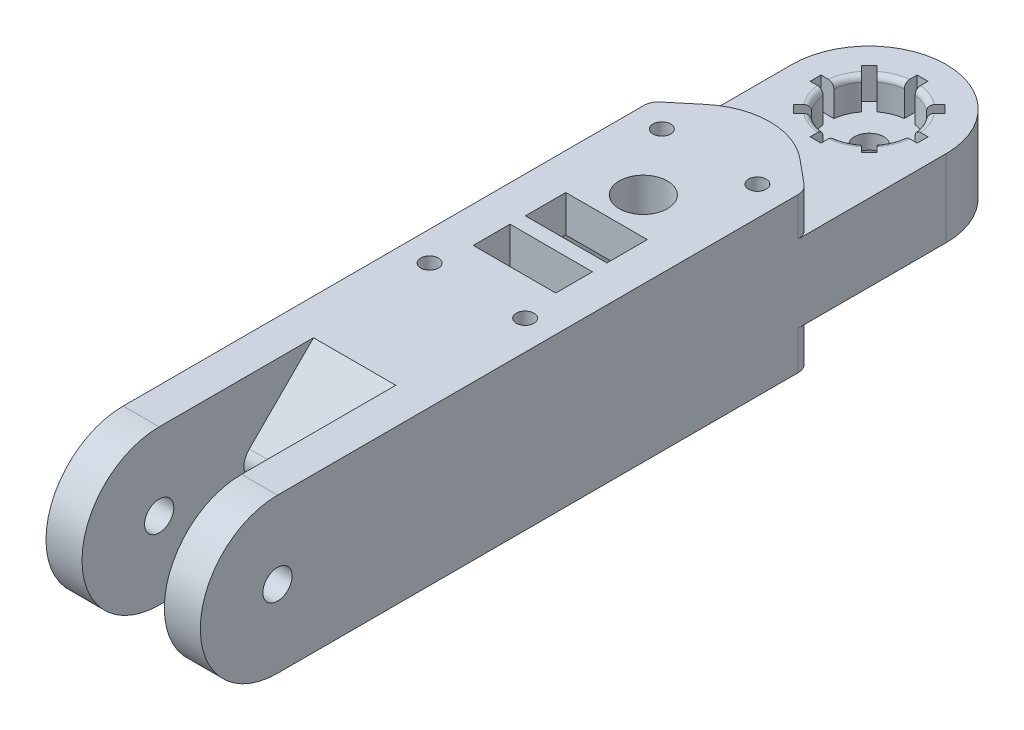
from build123d import *

# Parameters (mm, degrees)
SKETCH1_W                = 42
SKETCH1_H                = 42
BOSS_EXTRUDE1_DEPTH      = 140
SKETCH2_W                = 9.8
SKETCH2_H                = 42
BOSS_EXTRUDE2_DEPTH      = 21
BOSS_EXTRUDE4_DEPTH      = 9.8
BOSS_EXTRUDE5_START      = -9.8
BOSS_EXTRUDE5_DEPTH      = 9.8
SKETCH6_R                = 3.975
CUT_EXTRUDE1_DEPTH       = 187.015698262
SKETCH8_R                = 3.975
CUT_EXTRUDE2_DEPTH       = 187.015698262
SKETCH9_W                = 42
SKETCH9_H                = 21
BOSS_EXTRUDE6_DEPTH      = 21
BOSS_EXTRUDE7_DEPTH      = 21
SKETCH11_R               = 11.35
CUT_EXTRUDE3_DEPTH       = 8.5
CUT_EXTRUDE4_DEPTH       = 22.4
FILLET1_R                = 5
SKETCH18_R               = 11.1605
CUT_EXTRUDE5_DEPTH       = 8.5
SKETCH19_R               = 3.975
CUT_EXTRUDE6_DEPTH       = 8.5
FILLET4_R                = 1.5
FILLET5_R                = 1.5
SKETCH20_W               = 2.96
SKETCH20_H               = 3.81
CUT_EXTRUDE7_DEPTH       = 8.5
CIRPATTERN1_COUNT        = 8
MIRROR1_COPY_1_SKETCH_W  = 2.96
MIRROR1_COPY_1_SKETCH_H  = 3.81
MIRROR1_COPY_1_DEPTH     = 8.5
MIRROR1_COPY_2_SKETCH_W  = 2.96
MIRROR1_COPY_2_SKETCH_H  = 3.81
MIRROR1_COPY_2_DEPTH     = 8.5
MIRROR1_COPY_3_SKETCH_W  = 2.96
MIRROR1_COPY_3_SKETCH_H  = 3.81
MIRROR1_COPY_3_DEPTH     = 8.5
MIRROR1_COPY_4_SKETCH_W  = 2.96
MIRROR1_COPY_4_SKETCH_H  = 3.81
MIRROR1_COPY_4_DEPTH     = 8.5
MIRROR1_COPY_5_SKETCH_W  = 2.96
MIRROR1_COPY_5_SKETCH_H  = 3.81
MIRROR1_COPY_5_DEPTH     = 8.5
MIRROR1_COPY_6_SKETCH_W  = 2.96
MIRROR1_COPY_6_SKETCH_H  = 3.81
MIRROR1_COPY_6_DEPTH     = 8.5
MIRROR1_COPY_7_SKETCH_W  = 2.96
MIRROR1_COPY_7_SKETCH_H  = 3.81
MIRROR1_COPY_7_DEPTH     = 8.5
SKETCH25_W               = 34
SKETCH25_H               = 49
CUT_EXTRUDE11_DEPTH      = 32
SKETCH26_W               = 17
SKETCH26_H               = 3
SKETCH26_H_2             = 8.1
CUT_EXTRUDE12_DEPTH      = 27
SKETCH30_R               = 2.4
CUT_EXTRUDE13_DEPTH      = 186.186392589
FILLET10_R               = 3
MIRROR12_COPY_1_SKETCH_R = 2.4
MIRROR12_COPY_1_DEPTH    = 186.186392589
FILLET10_OF_MIRROR12_R   = 3
CUT_EXTRUDE16_DEPTH      = 10.5
FILLET12_R               = 20
FILLET12_OF_MIRROR13_R   = 20
FILLET13_R               = 4
SKETCH33_R               = 6.56
SKETCH33_W               = 22.45
SKETCH33_H               = 10
SKETCH33_W_2             = 22.2
SKETCH33_H_2             = 11
CUT_EXTRUDE17_DEPTH      = 186.981181844


with BuildPart() as part:
    # Sketch1 → Boss-Extrude1 (new body)
    with BuildSketch(Plane.XY):
        Rectangle(SKETCH1_W, SKETCH1_H)
    extrude(amount=BOSS_EXTRUDE1_DEPTH)

    # Sketch2 → Boss-Extrude2 (add)
    with BuildSketch(Plane.XY.offset(140)):
        with Locations((-16.1, 0)):
            Rectangle(SKETCH2_W, SKETCH2_H)
        with Locations((16.1, 0)):
            Rectangle(SKETCH2_W, SKETCH2_H)
    extrude(amount=BOSS_EXTRUDE2_DEPTH)

    # Sketch5 → Boss-Extrude4 (add)
    with BuildSketch(Plane.ZY.offset(-11.2)):
        with BuildLine():
            ThreePointArc((161, 21), (182, 0), (161, -21))
            Line((161, -21), (161, 21))
        make_face()
    extrude(amount=-BOSS_EXTRUDE4_DEPTH)

    # Sketch3 → Boss-Extrude5 (add)
    with BuildSketch(Plane(origin=(-11.2, 0, 0), x_dir=(0, 0, -1), z_dir=(1, 0, 0)).offset(BOSS_EXTRUDE5_START)):
        with BuildLine():
            Line((-161, -21), (-161, 21))
            ThreePointArc((-161, 21), (-182, 0), (-161, -21))
        make_face()
    extrude(amount=BOSS_EXTRUDE5_DEPTH)

    # Sketch6 → Cut-Extrude1 (cut, through all)
    with BuildSketch(Plane.ZY.offset(-11.2)):
        with Locations(Location((161, 0, 0), (0, 0, 270))):
            Circle(SKETCH6_R)
    extrude(amount=-CUT_EXTRUDE1_DEPTH, mode=Mode.SUBTRACT)

    # Sketch8 → Cut-Extrude2 (cut, through all)
    with BuildSketch(Plane(origin=(-11.2, 0, 0), x_dir=(0, 0, -1), z_dir=(1, 0, 0))):
        with Locations(Location((-161, 0, 0), (0, 0, 270))):
            Circle(SKETCH8_R)
    extrude(amount=-CUT_EXTRUDE2_DEPTH, mode=Mode.SUBTRACT)

    # Sketch9 → Boss-Extrude6 (add)
    with BuildSketch(Plane(origin=(0, 0, 0), x_dir=(-1, 0, 0), z_dir=(0, 0, -1))):
        Rectangle(SKETCH9_W, SKETCH9_H)
    extrude(amount=BOSS_EXTRUDE6_DEPTH)

    # Sketch10 → Boss-Extrude7 (add)
    with BuildSketch(Plane(origin=(0, -10.5, 0), x_dir=(-1, 0, 0), z_dir=(0, -1, 0))):
        with BuildLine():
            Line((-21, 21), (21, 21))
            ThreePointArc((21, 21), (0, 42), (-21, 21))
        make_face()
    extrude(amount=-BOSS_EXTRUDE7_DEPTH)

    # Sketch11 → Cut-Extrude3 (cut)
    with BuildSketch(Plane(origin=(0, -10.5, 0), x_dir=(-1, 0, 0), z_dir=(0, -1, 0))):
        with Locations(Location((0, 21, 0), (0, 0, 180))):
            Circle(SKETCH11_R)
    extrude(amount=-CUT_EXTRUDE3_DEPTH, mode=Mode.SUBTRACT)

    # Sketch16 → Cut-Extrude4 (cut)
    with BuildSketch(Plane.ZY.offset(-11.2)):
        Polygon((140, -21), (140, 0), (119, -21), align=None)
        Polygon((140, 0), (140, 21), (119, 21), align=None)
    extrude(amount=CUT_EXTRUDE4_DEPTH, mode=Mode.SUBTRACT)

    # Fillet1
    fillet1_edges = [part.edges().sort_by_distance(p)[0] for p in [
        (0, 0, 140),
    ]]
    fillet(fillet1_edges, radius=FILLET1_R)

    # Sketch18 → Cut-Extrude5 (cut)
    with BuildSketch(Plane(origin=(0, 10.5, 0), x_dir=(1, 0, 0), z_dir=(0, 1, 0))):
        with Locations(Location((0, 21, 0), (0, 0, 180))):
            Circle(SKETCH18_R)
    extrude(amount=-CUT_EXTRUDE5_DEPTH, mode=Mode.SUBTRACT)

    # Sketch19 → Cut-Extrude6 (cut)
    with BuildSketch(Plane.XZ.offset(2)):
        with Locations((0, -21)):
            Circle(SKETCH19_R)
    extrude(amount=-CUT_EXTRUDE6_DEPTH, mode=Mode.SUBTRACT)

    # Fillet4
    fillet4_edges = [part.edges().sort_by_distance(p)[0] for p in [
        (-11.35, -10.5, -21),
    ]]
    fillet(fillet4_edges, radius=FILLET4_R)

    # Fillet5
    fillet5_edges = [part.edges().sort_by_distance(p)[0] for p in [
        (11.1605, 10.5, -21),
    ]]
    fillet(fillet5_edges, radius=FILLET5_R)

    # Sketch20 → Cut-Extrude7 (cut)
    with BuildSketch(Plane(origin=(0, 10.5, 0), x_dir=(1, 0, 0), z_dir=(0, 1, 0))):
        with Locations((0, 33.6605)):
            Rectangle(SKETCH20_W, SKETCH20_H)
    cut_extrude7 = extrude(amount=-CUT_EXTRUDE7_DEPTH, mode=Mode.SUBTRACT)

    # CirPattern1: Cut-Extrude7 ×8 about axis
    cirpattern1_axis = Axis((0, 0, -21), (0, 1, 0))
    for i in range(1, CIRPATTERN1_COUNT):
        add(cut_extrude7.rotate(cirpattern1_axis, i * 360 / CIRPATTERN1_COUNT), mode=Mode.SUBTRACT)

    # Mirror1: Cut-Extrude7 across plane
    add(cut_extrude7.mirror(Plane.ZX), mode=Mode.SUBTRACT)

    # Mirror1 copy 1 sketch → Mirror1 copy 1 (cut)
    with BuildSketch(Plane(origin=(14.849242405, -10.5, -6.150757595), x_dir=(0.7071067811865476, 0, -0.7071067811865475), z_dir=(0, -1, 0))):
        with Locations((0, -33.6605)):
            Rectangle(MIRROR1_COPY_1_SKETCH_W, MIRROR1_COPY_1_SKETCH_H)
    extrude(amount=-MIRROR1_COPY_1_DEPTH, mode=Mode.SUBTRACT)

    # Mirror1 copy 2 sketch → Mirror1 copy 2 (cut)
    with BuildSketch(Plane(origin=(21, -10.5, -21), x_dir=(0, 0, -1), z_dir=(0, -1, 0))):
        with Locations((0, -33.6605)):
            Rectangle(MIRROR1_COPY_2_SKETCH_W, MIRROR1_COPY_2_SKETCH_H)
    extrude(amount=-MIRROR1_COPY_2_DEPTH, mode=Mode.SUBTRACT)

    # Mirror1 copy 3 sketch → Mirror1 copy 3 (cut)
    with BuildSketch(Plane(origin=(14.849242405, -10.5, -35.849242405), x_dir=(-0.7071067811865475, 0, -0.7071067811865476), z_dir=(0, -1, 0))):
        with Locations((0, -33.6605)):
            Rectangle(MIRROR1_COPY_3_SKETCH_W, MIRROR1_COPY_3_SKETCH_H)
    extrude(amount=-MIRROR1_COPY_3_DEPTH, mode=Mode.SUBTRACT)

    # Mirror1 copy 4 sketch → Mirror1 copy 4 (cut)
    with BuildSketch(Plane(origin=(0, -10.5, -42), x_dir=(-1, 0, 0), z_dir=(0, -1, 0))):
        with Locations((0, -33.6605)):
            Rectangle(MIRROR1_COPY_4_SKETCH_W, MIRROR1_COPY_4_SKETCH_H)
    extrude(amount=-MIRROR1_COPY_4_DEPTH, mode=Mode.SUBTRACT)

    # Mirror1 copy 5 sketch → Mirror1 copy 5 (cut)
    with BuildSketch(Plane(origin=(-14.849242405, -10.5, -35.849242405), x_dir=(-0.7071067811865477, 0, 0.7071067811865475), z_dir=(0, -1, 0))):
        with Locations((0, -33.6605)):
            Rectangle(MIRROR1_COPY_5_SKETCH_W, MIRROR1_COPY_5_SKETCH_H)
    extrude(amount=-MIRROR1_COPY_5_DEPTH, mode=Mode.SUBTRACT)

    # Mirror1 copy 6 sketch → Mirror1 copy 6 (cut)
    with BuildSketch(Plane(origin=(-21, -10.5, -21), x_dir=(0, 0, 1), z_dir=(0, -1, 0))):
        with Locations((0, -33.6605)):
            Rectangle(MIRROR1_COPY_6_SKETCH_W, MIRROR1_COPY_6_SKETCH_H)
    extrude(amount=-MIRROR1_COPY_6_DEPTH, mode=Mode.SUBTRACT)

    # Mirror1 copy 7 sketch → Mirror1 copy 7 (cut)
    with BuildSketch(Plane(origin=(-14.849242405, -10.5, -6.150757595), x_dir=(0.7071067811865474, 0, 0.7071067811865477), z_dir=(0, -1, 0))):
        with Locations((0, -33.6605)):
            Rectangle(MIRROR1_COPY_7_SKETCH_W, MIRROR1_COPY_7_SKETCH_H)
    extrude(amount=-MIRROR1_COPY_7_DEPTH, mode=Mode.SUBTRACT)

    # Sketch25 → Cut-Extrude11 (cut)
    with BuildSketch(Plane.XZ.offset(21)):
        with Locations((0, 54)):
            Rectangle(SKETCH25_W, SKETCH25_H)
    extrude(amount=-CUT_EXTRUDE11_DEPTH, mode=Mode.SUBTRACT)

    # Sketch26 → Cut-Extrude12 (cut)
    with BuildSketch(Plane.XZ.offset(21)):
        with Locations((8.5, 28)):
            Rectangle(SKETCH26_W, SKETCH26_H)
        with Locations((-8.5, 28)):
            Rectangle(SKETCH26_W, SKETCH26_H)
        with Locations((8.5, 22.45)):
            Rectangle(SKETCH26_W, SKETCH26_H_2)
        with Locations((-8.5, 22.45)):
            Rectangle(SKETCH26_W, SKETCH26_H_2)
    cut_extrude12 = extrude(amount=-CUT_EXTRUDE12_DEPTH, mode=Mode.SUBTRACT)

    # Sketch30 → Cut-Extrude13 (cut, through all)
    with BuildSketch(Plane.XZ.offset(-6)):
        with Locations(Location((-13, 22.4, 0), (0, 0, 270))):
            Circle(SKETCH30_R)
    cut_extrude13 = extrude(amount=-CUT_EXTRUDE13_DEPTH, mode=Mode.SUBTRACT)

    # Mirror9: Cut-Extrude13 across plane
    add(cut_extrude13.mirror(Plane.ZY), mode=Mode.SUBTRACT)

    # Fillet10
    fillet10_edges = [part.edges().sort_by_distance(p)[0] for p in [
        (17, -7.5, 18.4),
        (-17, -7.5, 18.4),
    ]]
    fillet(fillet10_edges, radius=FILLET10_R)

    # Mirror12: Cut-Extrude12, Cut-Extrude13 across plane
    add(cut_extrude12.mirror(Plane(origin=(0, 0, 54), x_dir=(1, 0, 0), z_dir=(0, 0, -1))), mode=Mode.SUBTRACT)
    add(cut_extrude13.mirror(Plane(origin=(0, 0, 54), x_dir=(1, 0, 0), z_dir=(0, 0, -1))), mode=Mode.SUBTRACT)

    # Mirror12 copy 1 sketch → Mirror12 copy 1 (cut, through all)
    with BuildSketch(Plane(origin=(0, 6, 108), x_dir=(-1, 0, 0), z_dir=(0, -1, 0))):
        with Locations(Location((-13, 22.4, 0), (0, 0, 270))):
            Circle(MIRROR12_COPY_1_SKETCH_R)
    extrude(amount=-MIRROR12_COPY_1_DEPTH, mode=Mode.SUBTRACT)

    # Fillet10 of Mirror12
    fillet10_of_mirror12_edges = [part.edges().sort_by_distance(p)[0] for p in [
        (17, -7.5, 89.6),
        (-17, -7.5, 89.6),
    ]]
    fillet(fillet10_of_mirror12_edges, radius=FILLET10_OF_MIRROR12_R)

    # Sketch32 → Cut-Extrude16 (cut)
    with BuildSketch(Plane(origin=(0, 21, 0), x_dir=(1, 0, 0), z_dir=(0, 1, 0))):
        Polygon((-21, -17.421516408), (0, 0), (-21, 0), align=None)
        Polygon((21, 0), (0, 0), (21, -17.421516408), align=None)
    cut_extrude16 = extrude(amount=-CUT_EXTRUDE16_DEPTH, mode=Mode.SUBTRACT)

    # Fillet12
    fillet12_edges = [part.edges().sort_by_distance(p)[0] for p in [
        (0, 15.75, 0),
    ]]
    fillet(fillet12_edges, radius=FILLET12_R)

    # Mirror13: Cut-Extrude16 across plane
    add(cut_extrude16.mirror(Plane.ZX), mode=Mode.SUBTRACT)

    # Fillet12 of Mirror13
    fillet12_of_mirror13_edges = [part.edges().sort_by_distance(p)[0] for p in [
        (0, -15.75, 0),
    ]]
    fillet(fillet12_of_mirror13_edges, radius=FILLET12_OF_MIRROR13_R)

    # Fillet13
    fillet13_edges = [part.edges().sort_by_distance(p)[0] for p in [
        (-21, 15.75, 17.421516408),
        (21, 15.75, 17.421516408),
        (-21, -15.75, 17.421516408),
        (21, -15.75, 17.421516408),
    ]]
    fillet(fillet13_edges, radius=FILLET13_R)

    # Sketch33 → Cut-Extrude17 (cut, through all)
    with BuildSketch(Plane.XZ.offset(-11)):
        with Locations(Location((0, 40.44, 0), (0, 0, 270))):
            Circle(SKETCH33_R)
        with Locations((0, 70.5)):
            Rectangle(SKETCH33_W, SKETCH33_H)
        with Locations((0, 55.94)):
            Rectangle(SKETCH33_W_2, SKETCH33_H_2)
    extrude(amount=-CUT_EXTRUDE17_DEPTH, mode=Mode.SUBTRACT)


solid = part.part
